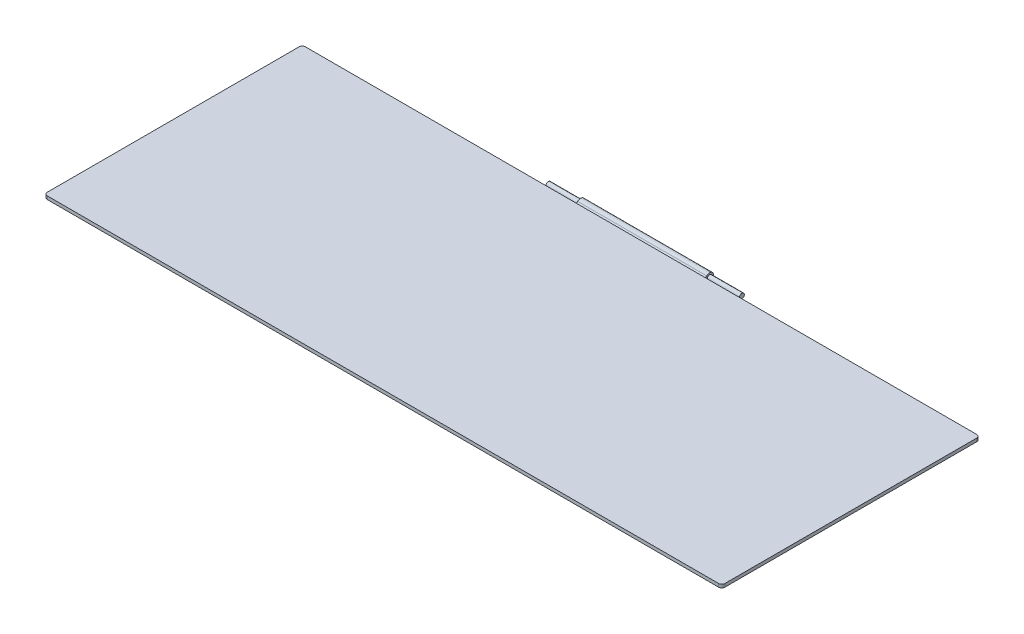
from build123d import *

# Parameters (mm, degrees)
SKETCH1_W           = 533.4
SKETCH1_H           = 2.54
BOSS_EXTRUDE1_DEPTH = 203.2
FILLET1_R           = 2.54
SKETCH3_R           = 3.175
BOSS_EXTRUDE2_DEPTH = 101.6
SKETCH5_R           = 1.905
BOSS_EXTRUDE3_DEPTH = 25.4
BOSS_EXTRUDE4_START = 25.4
SKETCH6_R           = 1.905
BOSS_EXTRUDE4_DEPTH = 25.4


with BuildPart() as part:
    # Sketch1 → Boss-Extrude1 (new body)
    with BuildSketch(Plane.XY):
        Rectangle(SKETCH1_W, SKETCH1_H)
    extrude(amount=BOSS_EXTRUDE1_DEPTH)

    # Fillet1
    fillet1_edges = [part.edges().sort_by_distance(p)[0] for p in [
        (-266.7, 0, 203.2),
        (266.7, 0, 203.2),
        (-266.7, 0, 0),
        (266.7, 0, 0),
    ]]
    fillet(fillet1_edges, radius=FILLET1_R)

    # Sketch3 → Boss-Extrude2 (add)
    with BuildSketch(Plane.ZY.offset(50.8)):
        with BuildLine():
            ThreePointArc((-0.875862069, 2.189655172), (-0.227086506, 1.179165397), (0, 0))
            Line((0, 0), (0, 1.27))
            Line((0, 1.27), (-0.875862069, 2.189655172))
        make_face()
        with BuildLine():
            Line((-0.875862069, -2.189655172), (0, -1.27))
            Line((0, -1.27), (0, 0))
            ThreePointArc((0, 0), (-0.227086506, -1.179165397), (-0.875862069, -2.189655172))
        make_face()
        with Locations((-3.175, 0)):
            Circle(SKETCH3_R)
    extrude(amount=-BOSS_EXTRUDE2_DEPTH)

    # Sketch5 → Boss-Extrude3 (add)
    with BuildSketch(Plane.ZY.offset(50.8)):
        with Locations((-3.175, 0)):
            Circle(SKETCH5_R)
    extrude(amount=BOSS_EXTRUDE3_DEPTH)

    # Sketch6 → Boss-Extrude4 (add)
    with BuildSketch(Plane(origin=(50.8, 0, 0), x_dir=(0, 0, -1), z_dir=(1, 0, 0)).offset(BOSS_EXTRUDE4_START)):
        with Locations(Location((3.175, 0, 0), (0, 0, 180))):
            Circle(SKETCH6_R)
    extrude(amount=-BOSS_EXTRUDE4_DEPTH)


solid = part.part
